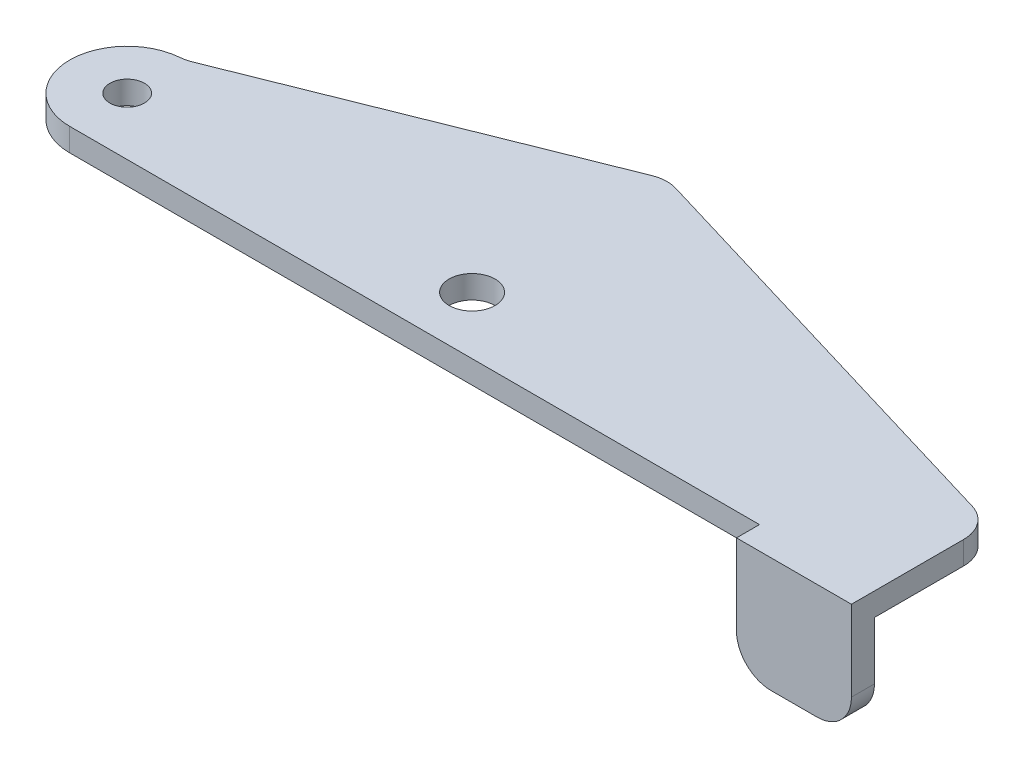
from build123d import *

# Parameters (mm, degrees)
SKETCH_1_R      = 1.5
SKETCH_1_R_2    = 2
EXTRUDE_1_DEPTH = 2
SKETCH_2_W      = 10
SKETCH_2_H      = 2
EXTRUDE_2_DEPTH = 10
FILLET_1_R      = 3
FILLET_2_R      = 3


with BuildPart() as part:
    # 草图1 → 凸台-拉伸1 (new body)
    with BuildSketch(Plane(origin=(0, 0, 0), x_dir=(1, 0, 0), z_dir=(0, 1, 0))):
        with BuildLine():
            Line((-30, 5), (0, 17))
            Line((0, 17), (40, 5))
            Line((40, 5), (40, -5))
            Line((40, -5), (-30, -5))
            ThreePointArc((-30, -5), (-35, 0), (-30, 5))
        make_face()
        with Locations(Location((-30, 0, 0), (0, 0, 270))):
            Circle(SKETCH_1_R, mode=Mode.SUBTRACT)
        with Locations(Location((0, 0, 0), (0, 0, 270))):
            Circle(SKETCH_1_R_2, mode=Mode.SUBTRACT)
    extrude(amount=EXTRUDE_1_DEPTH)

    # 草图2 → 凸台-拉伸2 (add)
    with BuildSketch(Plane(origin=(0, 2, 0), x_dir=(1, 0, 0), z_dir=(0, 1, 0))):
        with Locations((35, -6)):
            Rectangle(SKETCH_2_W, SKETCH_2_H)
    extrude(amount=-EXTRUDE_2_DEPTH)

    # 圆角1
    fillet_1_edges = [part.edges().sort_by_distance(p)[0] for p in [
        (-30, 1, -5),
        (0, 1, -17),
        (40, 1, -5),
    ]]
    fillet(fillet_1_edges, radius=FILLET_1_R)

    # 圆角2
    fillet_2_edges = [part.edges().sort_by_distance(p)[0] for p in [
        (40, -8, 6),
        (30, -8, 6),
    ]]
    fillet(fillet_2_edges, radius=FILLET_2_R)


solid = part.part
